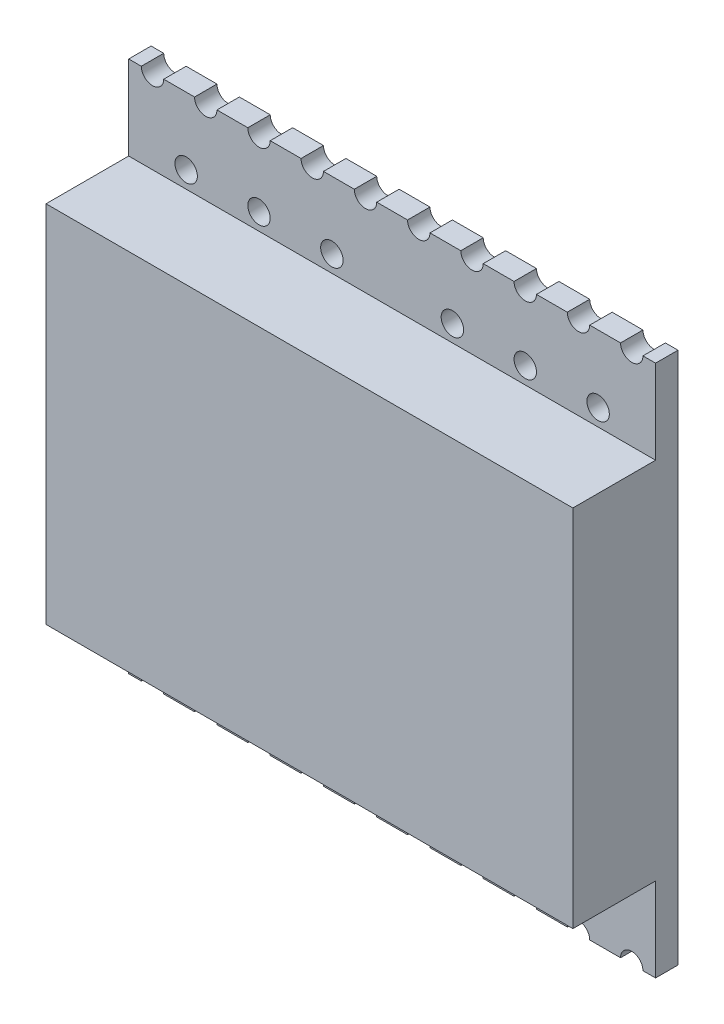
from build123d import *

# Parameters (mm, degrees)
SKETCH_1_W                    = 18.8
SKETCH_1_H                    = 19
EXTRUDE_1_DEPTH               = 0.8
SKETCH_2_W                    = 18.8
SKETCH_2_H                    = 13
EXTRUDE_2_DEPTH               = 2.95
CUT_EXTRUDE_1_DEPTH           = 14.686215693
PATTERN_LINEAR_1_COUNT        = 10
PATTERN_LINEAR_1_PITCH        = 1.9
PATTERN_LINEAR_1_COPY_1_DEPTH = 14.686215693
PATTERN_LINEAR_1_COPY_2_DEPTH = 14.686215693
PATTERN_LINEAR_1_COPY_3_DEPTH = 14.686215693
PATTERN_LINEAR_1_COPY_4_DEPTH = 14.686215693
PATTERN_LINEAR_1_COPY_5_DEPTH = 14.686215693
PATTERN_LINEAR_1_COPY_6_DEPTH = 14.686215693
PATTERN_LINEAR_1_COPY_7_DEPTH = 14.686215693
PATTERN_LINEAR_1_COPY_8_DEPTH = 14.686215693
PATTERN_LINEAR_1_COPY_9_DEPTH = 14.686215693
SKETCH_4_R                    = 0.4
CUT_EXTRUDE_2_DEPTH           = 14.686215693
PATTERN_LINEAR_2_COUNT        = 3
PATTERN_LINEAR_2_PITCH        = 2.6
MIRROR_2_COPY_1_SKETCH_R      = 0.4
MIRROR_2_COPY_1_DEPTH         = 14.686215693
MIRROR_2_COPY_2_SKETCH_R      = 0.4
MIRROR_2_COPY_2_DEPTH         = 14.686215693
MIRROR_3_COPY_1_SKETCH_R      = 0.4
MIRROR_3_COPY_1_DEPTH         = 14.686215693
MIRROR_3_COPY_2_SKETCH_R      = 0.4
MIRROR_3_COPY_2_DEPTH         = 14.686215693
MIRROR_3_COPY_3_SKETCH_R      = 0.4
MIRROR_3_COPY_3_DEPTH         = 14.686215693
MIRROR_3_COPY_4_SKETCH_R      = 0.4
MIRROR_3_COPY_4_DEPTH         = 14.686215693
MIRROR_3_COPY_5_SKETCH_R      = 0.4
MIRROR_3_COPY_5_DEPTH         = 14.686215693


with BuildPart() as part:
    # Эскиз1 → Бобышка-Вытянуть1 (new body)
    with BuildSketch(Plane.XY):
        Rectangle(SKETCH_1_W, SKETCH_1_H)
    extrude(amount=EXTRUDE_1_DEPTH)

    # Эскиз2 → Бобышка-Вытянуть2 (add)
    with BuildSketch(Plane.XY.offset(0.8)):
        Rectangle(SKETCH_2_W, SKETCH_2_H)
    extrude(amount=EXTRUDE_2_DEPTH)

    # Эскиз3 → Вырез-Вытянуть1 (cut, symmetric)
    with BuildSketch(Plane.XY.offset(0.8)):
        with BuildLine():
            Line((-8.95, -9.5), (-8.15, -9.5))
            ThreePointArc((-8.15, -9.5), (-8.55, -9.1), (-8.95, -9.5))
        make_face()
    cut_extrude_1 = extrude(amount=CUT_EXTRUDE_1_DEPTH, both=True, mode=Mode.SUBTRACT)

    # Зеркальное отражение1: Вырез-Вытянуть1 across plane
    add(cut_extrude_1.mirror(Plane.ZX), mode=Mode.SUBTRACT)

    # Линейный массив1: Вырез-Вытянуть1 ×10
    with Locations(*[(i * PATTERN_LINEAR_1_PITCH, 0, 0) for i in range(1, PATTERN_LINEAR_1_COUNT)]):
        add(cut_extrude_1, mode=Mode.SUBTRACT)

    # Линейный массив1 copy 1 sketch → Линейный массив1 copy 1 (cut, symmetric)
    with BuildSketch(Plane(origin=(1.9, 0, 0.8), x_dir=(1, 0, 0), z_dir=(0, 0, 1))):
        with BuildLine():
            Line((-8.95, 9.5), (-8.15, 9.5))
            ThreePointArc((-8.15, 9.5), (-8.55, 9.1), (-8.95, 9.5))
        make_face()
    extrude(amount=PATTERN_LINEAR_1_COPY_1_DEPTH, both=True, mode=Mode.SUBTRACT)

    # Линейный массив1 copy 2 sketch → Линейный массив1 copy 2 (cut, symmetric)
    with BuildSketch(Plane(origin=(3.8, 0, 0.8), x_dir=(1, 0, 0), z_dir=(0, 0, 1))):
        with BuildLine():
            Line((-8.95, 9.5), (-8.15, 9.5))
            ThreePointArc((-8.15, 9.5), (-8.55, 9.1), (-8.95, 9.5))
        make_face()
    extrude(amount=PATTERN_LINEAR_1_COPY_2_DEPTH, both=True, mode=Mode.SUBTRACT)

    # Линейный массив1 copy 3 sketch → Линейный массив1 copy 3 (cut, symmetric)
    with BuildSketch(Plane(origin=(5.7, 0, 0.8), x_dir=(1, 0, 0), z_dir=(0, 0, 1))):
        with BuildLine():
            Line((-8.95, 9.5), (-8.15, 9.5))
            ThreePointArc((-8.15, 9.5), (-8.55, 9.1), (-8.95, 9.5))
        make_face()
    extrude(amount=PATTERN_LINEAR_1_COPY_3_DEPTH, both=True, mode=Mode.SUBTRACT)

    # Линейный массив1 copy 4 sketch → Линейный массив1 copy 4 (cut, symmetric)
    with BuildSketch(Plane(origin=(7.6, 0, 0.8), x_dir=(1, 0, 0), z_dir=(0, 0, 1))):
        with BuildLine():
            Line((-8.95, 9.5), (-8.15, 9.5))
            ThreePointArc((-8.15, 9.5), (-8.55, 9.1), (-8.95, 9.5))
        make_face()
    extrude(amount=PATTERN_LINEAR_1_COPY_4_DEPTH, both=True, mode=Mode.SUBTRACT)

    # Линейный массив1 copy 5 sketch → Линейный массив1 copy 5 (cut, symmetric)
    with BuildSketch(Plane(origin=(9.5, 0, 0.8), x_dir=(1, 0, 0), z_dir=(0, 0, 1))):
        with BuildLine():
            Line((-8.95, 9.5), (-8.15, 9.5))
            ThreePointArc((-8.15, 9.5), (-8.55, 9.1), (-8.95, 9.5))
        make_face()
    extrude(amount=PATTERN_LINEAR_1_COPY_5_DEPTH, both=True, mode=Mode.SUBTRACT)

    # Линейный массив1 copy 6 sketch → Линейный массив1 copy 6 (cut, symmetric)
    with BuildSketch(Plane(origin=(11.4, 0, 0.8), x_dir=(1, 0, 0), z_dir=(0, 0, 1))):
        with BuildLine():
            Line((-8.95, 9.5), (-8.15, 9.5))
            ThreePointArc((-8.15, 9.5), (-8.55, 9.1), (-8.95, 9.5))
        make_face()
    extrude(amount=PATTERN_LINEAR_1_COPY_6_DEPTH, both=True, mode=Mode.SUBTRACT)

    # Линейный массив1 copy 7 sketch → Линейный массив1 copy 7 (cut, symmetric)
    with BuildSketch(Plane(origin=(13.3, 0, 0.8), x_dir=(1, 0, 0), z_dir=(0, 0, 1))):
        with BuildLine():
            Line((-8.95, 9.5), (-8.15, 9.5))
            ThreePointArc((-8.15, 9.5), (-8.55, 9.1), (-8.95, 9.5))
        make_face()
    extrude(amount=PATTERN_LINEAR_1_COPY_7_DEPTH, both=True, mode=Mode.SUBTRACT)

    # Линейный массив1 copy 8 sketch → Линейный массив1 copy 8 (cut, symmetric)
    with BuildSketch(Plane(origin=(15.2, 0, 0.8), x_dir=(1, 0, 0), z_dir=(0, 0, 1))):
        with BuildLine():
            Line((-8.95, 9.5), (-8.15, 9.5))
            ThreePointArc((-8.15, 9.5), (-8.55, 9.1), (-8.95, 9.5))
        make_face()
    extrude(amount=PATTERN_LINEAR_1_COPY_8_DEPTH, both=True, mode=Mode.SUBTRACT)

    # Линейный массив1 copy 9 sketch → Линейный массив1 copy 9 (cut, symmetric)
    with BuildSketch(Plane(origin=(17.1, 0, 0.8), x_dir=(1, 0, 0), z_dir=(0, 0, 1))):
        with BuildLine():
            Line((-8.95, 9.5), (-8.15, 9.5))
            ThreePointArc((-8.15, 9.5), (-8.55, 9.1), (-8.95, 9.5))
        make_face()
    extrude(amount=PATTERN_LINEAR_1_COPY_9_DEPTH, both=True, mode=Mode.SUBTRACT)

    # Эскиз4 → Вырез-Вытянуть2 (cut, symmetric)
    with BuildSketch(Plane.XY.offset(0.8)):
        with Locations((-2.15, -7.1)):
            Circle(SKETCH_4_R)
    cut_extrude_2 = extrude(amount=CUT_EXTRUDE_2_DEPTH, both=True, mode=Mode.SUBTRACT)

    # Линейный массив2: Вырез-Вытянуть2 ×3
    with Locations(*[(-i * PATTERN_LINEAR_2_PITCH, 0, 0) for i in range(1, PATTERN_LINEAR_2_COUNT)]):
        add(cut_extrude_2, mode=Mode.SUBTRACT)

    # Зеркальное отражение2: Вырез-Вытянуть2 across plane
    add(cut_extrude_2.mirror(Plane.ZX), mode=Mode.SUBTRACT)

    # Зеркальное отражение2 copy 1 sketch → Зеркальное отражение2 copy 1 (cut, symmetric)
    with BuildSketch(Plane(origin=(-2.6, 0, 0.8), x_dir=(1, 0, 0), z_dir=(0, 0, 1))):
        with Locations((-2.15, 7.1)):
            Circle(MIRROR_2_COPY_1_SKETCH_R)
    extrude(amount=MIRROR_2_COPY_1_DEPTH, both=True, mode=Mode.SUBTRACT)

    # Зеркальное отражение2 copy 2 sketch → Зеркальное отражение2 copy 2 (cut, symmetric)
    with BuildSketch(Plane(origin=(-5.2, 0, 0.8), x_dir=(1, 0, 0), z_dir=(0, 0, 1))):
        with Locations((-2.15, 7.1)):
            Circle(MIRROR_2_COPY_2_SKETCH_R)
    extrude(amount=MIRROR_2_COPY_2_DEPTH, both=True, mode=Mode.SUBTRACT)

    # Зеркальное отражение3: Вырез-Вытянуть2 across plane
    add(cut_extrude_2.mirror(Plane(origin=(0, 0, 0), x_dir=(0, 0, 1), z_dir=(1, 0, 0))), mode=Mode.SUBTRACT)

    # Зеркальное отражение3 copy 1 sketch → Зеркальное отражение3 copy 1 (cut, symmetric)
    with BuildSketch(Plane(origin=(2.6, 0, 0.8), x_dir=(-1, 0, 0), z_dir=(0, 0, 1))):
        with Locations((-2.15, 7.1)):
            Circle(MIRROR_3_COPY_1_SKETCH_R)
    extrude(amount=MIRROR_3_COPY_1_DEPTH, both=True, mode=Mode.SUBTRACT)

    # Зеркальное отражение3 copy 2 sketch → Зеркальное отражение3 copy 2 (cut, symmetric)
    with BuildSketch(Plane(origin=(5.2, 0, 0.8), x_dir=(-1, 0, 0), z_dir=(0, 0, 1))):
        with Locations((-2.15, 7.1)):
            Circle(MIRROR_3_COPY_2_SKETCH_R)
    extrude(amount=MIRROR_3_COPY_2_DEPTH, both=True, mode=Mode.SUBTRACT)

    # Зеркальное отражение3 copy 3 sketch → Зеркальное отражение3 copy 3 (cut, symmetric)
    with BuildSketch(Plane(origin=(0, 0, 0.8), x_dir=(-1, 0, 0), z_dir=(0, 0, 1))):
        with Locations((-2.15, -7.1)):
            Circle(MIRROR_3_COPY_3_SKETCH_R)
    extrude(amount=MIRROR_3_COPY_3_DEPTH, both=True, mode=Mode.SUBTRACT)

    # Зеркальное отражение3 copy 4 sketch → Зеркальное отражение3 copy 4 (cut, symmetric)
    with BuildSketch(Plane(origin=(2.6, 0, 0.8), x_dir=(-1, 0, 0), z_dir=(0, 0, 1))):
        with Locations((-2.15, -7.1)):
            Circle(MIRROR_3_COPY_4_SKETCH_R)
    extrude(amount=MIRROR_3_COPY_4_DEPTH, both=True, mode=Mode.SUBTRACT)

    # Зеркальное отражение3 copy 5 sketch → Зеркальное отражение3 copy 5 (cut, symmetric)
    with BuildSketch(Plane(origin=(5.2, 0, 0.8), x_dir=(-1, 0, 0), z_dir=(0, 0, 1))):
        with Locations((-2.15, -7.1)):
            Circle(MIRROR_3_COPY_5_SKETCH_R)
    extrude(amount=MIRROR_3_COPY_5_DEPTH, both=True, mode=Mode.SUBTRACT)


solid = part.part
